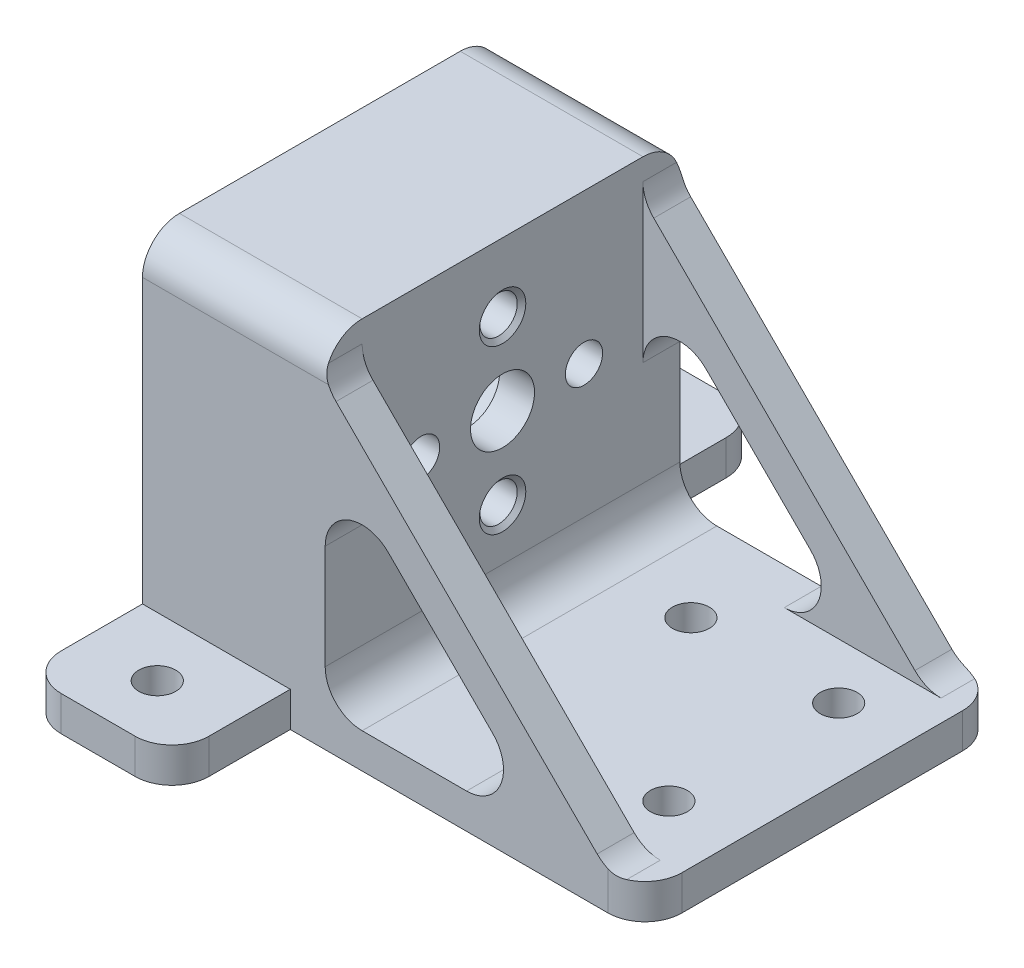
from build123d import *

# Parameters (mm, degrees)
SKETCH1_W                      = 30.48
SKETCH1_H                      = 30.48
BOSS_EXTRUDE1_DEPTH            = 30.48
SKETCH2_W                      = 27.48
SKETCH2_H                      = 27.48
CUT_EXTRUDE1_DEPTH             = 46.72
F_10_CLEARANCE_HOLE1_D         = 5.5
F_4_CLEARANCE_HOLE1_D          = 3.2
CHAMFER1_SIZE                  = 0.399999962
CHAMFER1_SIZE2                 = 0.335639821
FILLET1_R                      = 3.175
BOSS_EXTRUDE2_DEPTH            = 3.175
SKETCH20_R                     = 11
BOSS_EXTRUDE3_DEPTH            = 12.7
SKETCH21_W                     = 12.7
SKETCH21_H                     = 50.8
BOSS_EXTRUDE4_DEPTH            = 3
FILLET2_R                      = 3.175
F_1_8_0_1250_DOWEL_HOLE1_D     = 3.175
F_1_8_0_1250_DOWEL_HOLE1_DEPTH = 6.35
F_1_8_0_1250_DOWEL_HOLE1_TIP   = 0.953866233
F_1_8_0_1250_DOWEL_HOLE2_D     = 3.175
F_1_8_0_1250_DOWEL_HOLE2_DEPTH = 6.35
F_1_8_0_1250_DOWEL_HOLE2_TIP   = 0.953866233


with BuildPart() as part:
    # Sketch1 → Boss-Extrude1 (new body)
    with BuildSketch(Plane.XZ):
        Rectangle(SKETCH1_W, SKETCH1_H)
    extrude(amount=-BOSS_EXTRUDE1_DEPTH)

    # Sketch2 → Cut-Extrude1 (cut, through all)
    with BuildSketch(Plane(origin=(0, 0, -15.24), x_dir=(-1, 0, 0), z_dir=(0, 0, -1))):
        with Locations((-1.5, 16.74)):
            Rectangle(SKETCH2_W, SKETCH2_H)
    extrude(amount=-CUT_EXTRUDE1_DEPTH, mode=Mode.SUBTRACT)

    # #10 Clearance Hole1 (through all)
    with Locations(Plane(origin=(-12.24, 0, 0), x_dir=(0, 0, -1), z_dir=(1, 0, 0))):
        with Locations((0, 17.605)):
            Hole(F_10_CLEARANCE_HOLE1_D / 2)

    # #4 Clearance Hole1 (through all)
    with Locations(Plane(origin=(-12.24, 0, 0), x_dir=(0, 0, -1), z_dir=(1, 0, 0))):
        with Locations((-7, 17.605), (7, 17.605), (0, 24.605), (0, 10.605)):
            Hole(F_4_CLEARANCE_HOLE1_D / 2)

    # Chamfer1
    chamfer1_edges = [part.edges().sort_by_distance(p)[0] for p in [
        (-12.24, 10.605, -1.6),
        (-12.24, 24.605, -1.6),
    ]]
    chamfer1_side = [part.faces().sort_by_distance(p)[0] for p in [
        (-12.24, 16.74, -14.829612281),
    ]]
    chamfer(chamfer1_edges, length=CHAMFER1_SIZE, length2=CHAMFER1_SIZE2, reference=chamfer1_side[0])

    # Fillet1
    fillet1_edges = [part.edges().sort_by_distance(p)[0] for p in [
        (-13.74, 30.48, 15.24),
        (15.24, 1.5, -15.24),
        (15.24, 1.5, 15.24),
        (-12.24, 3, 0),
        (-13.74, 30.48, -15.24),
    ]]
    fillet(fillet1_edges, radius=FILLET1_R)

    # Sketch11 → Boss-Extrude2 (add)
    with BuildSketch(Plane.XY.offset(15.24)):
        Polygon((-12.24, 27.305), (12.065, 3), (7.574871939, 3), (-12.24, 22.814871939), align=None)
    boss_extrude2 = extrude(amount=-BOSS_EXTRUDE2_DEPTH)

    # Mirror1: Boss-Extrude2 across plane
    add(boss_extrude2.mirror(Plane(origin=(0, 0, 0), x_dir=(1, 0, 0), z_dir=(0, 0, -1))))

    # Sketch20 → Boss-Extrude3 (add)
    with BuildSketch(Plane.ZY.offset(15.24)):
        with BuildLine():
            Line((15.24, 0), (15.24, 27.305))
            ThreePointArc((15.24, 27.305), (14.31006403, 29.55006403), (12.065, 30.48))
            Line((12.065, 30.48), (-12.065, 30.48))
            ThreePointArc((-12.065, 30.48), (-14.31006403, 29.55006403), (-15.24, 27.305))
            Line((-15.24, 27.305), (-15.24, 0))
            Line((-15.24, 0), (15.24, 0))
        make_face()
        with Locations((0, 17.605)):
            Circle(SKETCH20_R, mode=Mode.SUBTRACT)
    extrude(amount=BOSS_EXTRUDE3_DEPTH)

    # Sketch21 → Boss-Extrude4 (add)
    with BuildSketch(Plane.XZ):
        with Locations((-21.59, 0)):
            Rectangle(SKETCH21_W, SKETCH21_H)
    extrude(amount=-BOSS_EXTRUDE4_DEPTH)

    # Fillet2
    fillet2_edges = [part.edges().sort_by_distance(p)[0] for p in [
        (-12.24, 27.305, -13.6525),
        (-12.24, 22.814871939, -13.6525),
        (7.574871939, 3, -13.6525),
        (12.065, 3, -13.6525),
        (-15.24, 1.5, 25.4),
        (-27.94, 1.5, -25.4),
        (-27.94, 1.5, 25.4),
        (-15.24, 1.5, -25.4),
        (-12.24, 22.814871939, 13.6525),
        (-12.24, 27.305, 13.6525),
        (12.065, 3, 13.6525),
        (7.574871939, 3, 13.6525),
    ]]
    fillet(fillet2_edges, radius=FILLET2_R)

    # 1/8 (0.1250) Dowel Hole1
    with Locations(Plane(origin=(0, 3, 0), x_dir=(1, 0, 0), z_dir=(0, 1, 0))):
        with Locations((-3.35, 7.29577013), (9.35, 7.29577013), (9.35, -7.29577013), (-3.35, -7.29577013)):
            Hole(F_1_8_0_1250_DOWEL_HOLE1_D / 2, depth=F_1_8_0_1250_DOWEL_HOLE1_DEPTH)
            with Locations((0, 0, -(F_1_8_0_1250_DOWEL_HOLE1_DEPTH + F_1_8_0_1250_DOWEL_HOLE1_TIP / 2))):  # 118° drill point
                Cone(0, F_1_8_0_1250_DOWEL_HOLE1_D / 2, F_1_8_0_1250_DOWEL_HOLE1_TIP, mode=Mode.SUBTRACT)

    # 1/8 (0.1250) Dowel Hole2
    with Locations(Plane(origin=(0, 3, 0), x_dir=(1, 0, 0), z_dir=(0, 1, 0))):
        with Locations((-21.59, 20.32), (-21.59, -20.32)):
            Hole(F_1_8_0_1250_DOWEL_HOLE2_D / 2, depth=F_1_8_0_1250_DOWEL_HOLE2_DEPTH)
            with Locations((0, 0, -(F_1_8_0_1250_DOWEL_HOLE2_DEPTH + F_1_8_0_1250_DOWEL_HOLE2_TIP / 2))):  # 118° drill point
                Cone(0, F_1_8_0_1250_DOWEL_HOLE2_D / 2, F_1_8_0_1250_DOWEL_HOLE2_TIP, mode=Mode.SUBTRACT)


solid = part.part
